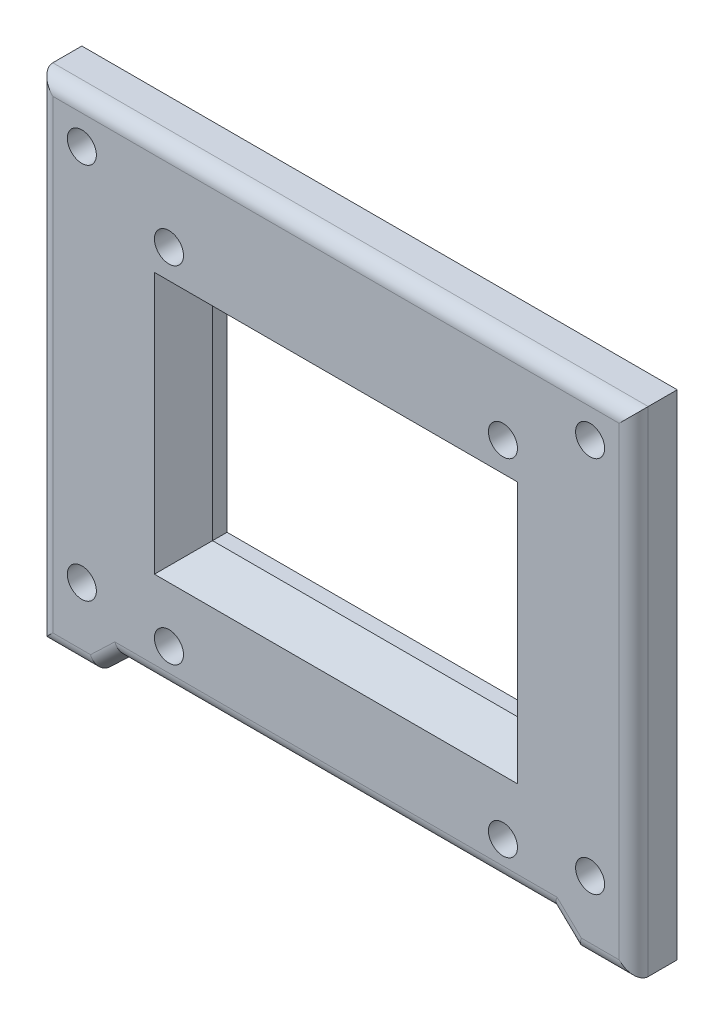
from build123d import *

# Parameters (mm, degrees)
SKETCH_1_R          = 1
SKETCH_1_W          = 21
SKETCH_1_H          = 14
EXTRUDE_1_DEPTH     = 3
CHAMFER_1_SIZE      = 2
FILLET_2_R          = 1
SKETCH_11_R         = 1
CUT_EXTRUDE_1_DEPTH = 33.992893462


with BuildPart() as part:
    # 草图1 → 凸台-拉伸1 (new body)
    with BuildSketch(Plane.XY):
        Polygon((-21.428351104, 24.906962627), (19.571648896, 24.906962627), (19.571648896, -9.093037373), (17.69677195, -9.093037373), (15.571648896, -9.093037373), (13.89965532, -7.493037373), (-15.756357529, -7.493037373), (-17.428351104, -9.093037373), (-21.428351104, -9.093037373), align=None)
        with Locations((-12.428351104, 18.906962627)):
            Circle(SKETCH_1_R, mode=Mode.SUBTRACT)
        with Locations((-12.428351104, -4.893037373)):
            Circle(SKETCH_1_R, mode=Mode.SUBTRACT)
        with Locations((10.571648896, 18.906962627)):
            Circle(SKETCH_1_R, mode=Mode.SUBTRACT)
        with Locations((10.571648896, -4.893037373)):
            Circle(SKETCH_1_R, mode=Mode.SUBTRACT)
        with Locations((-0.928351104, 7.906962627)):
            Rectangle(SKETCH_1_W, SKETCH_1_H, mode=Mode.SUBTRACT)
    extrude(amount=EXTRUDE_1_DEPTH)

    # 倒角1
    chamfer_1_edges = [part.edges().sort_by_distance(p)[0] for p in [
        (-11.428351104, 7.906962627, 3),
        (-0.928351104, 0.906962627, 3),
        (9.571648896, 7.906962627, 3),
        (-0.928351104, 14.906962627, 3),
    ]]
    chamfer(chamfer_1_edges, length=CHAMFER_1_SIZE)

    # 圆角2
    fillet_2_edges = [part.edges().sort_by_distance(p)[0] for p in [
        (-16.592354317, -8.293037373, 3),
        (-0.928351104, -7.493037373, 3),
        (14.735652108, -8.293037373, 3),
        (17.571648896, -9.093037373, 3),
        (19.571648896, 7.906962627, 3),
        (-0.928351104, 24.906962627, 3),
        (-21.428351104, 7.906962627, 3),
        (-19.428351104, -9.093037373, 3),
    ]]
    fillet(fillet_2_edges, radius=FILLET_2_R)

    # 草图11 → 切除-拉伸1 (cut, through all)
    with BuildSketch(Plane.XY.offset(3)):
        with Locations((-18.428351104, 21.906962627)):
            Circle(SKETCH_11_R)
        with Locations((-18.428351104, -4.093037373)):
            Circle(SKETCH_11_R)
        with Locations((16.571648896, 21.906962627)):
            Circle(SKETCH_11_R)
        with Locations((16.571648896, -4.093037373)):
            Circle(SKETCH_11_R)
    extrude(amount=-CUT_EXTRUDE_1_DEPTH, mode=Mode.SUBTRACT)


solid = part.part
